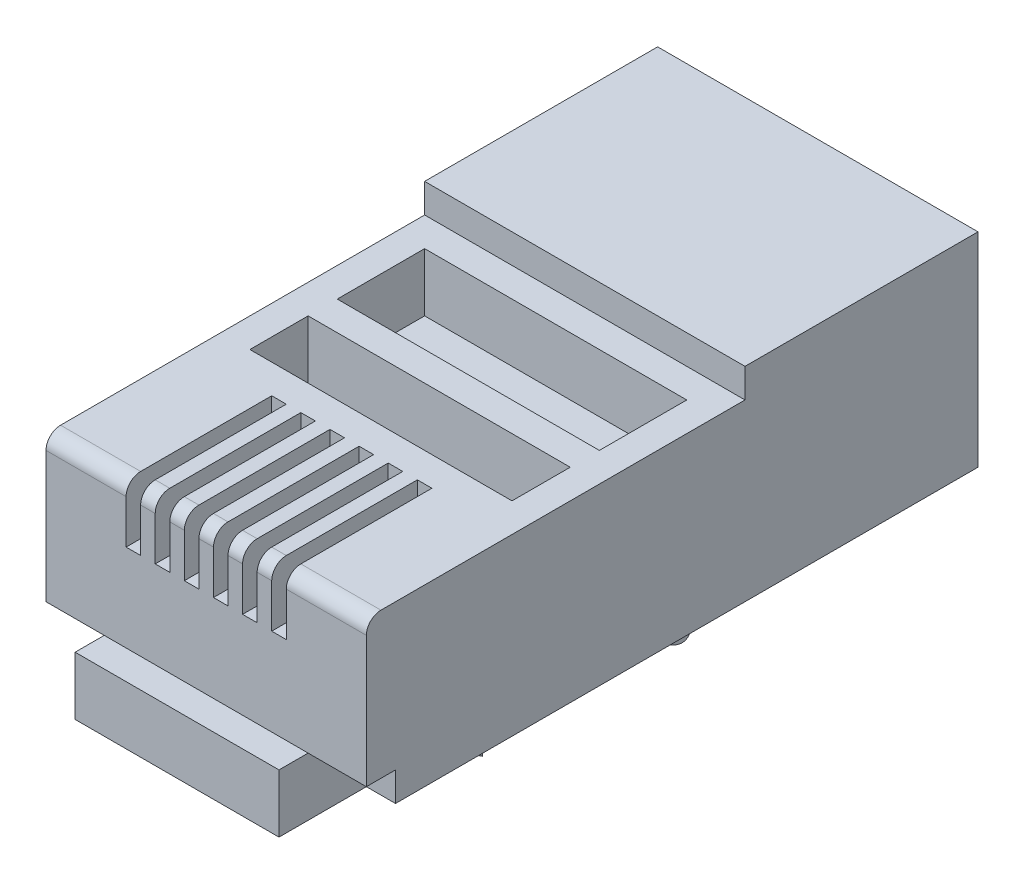
from build123d import *

# Parameters (mm, degrees)
BOSS_EXTRUDE1_DEPTH = 5
SKETCH2_W           = 11
SKETCH2_H           = 6
BOSS_EXTRUDE2_DEPTH = 8
SKETCH3_W           = 9
SKETCH3_H           = 2
CUT_EXTRUDE1_DEPTH  = 2
SKETCH5_W           = 9
SKETCH5_H           = 3
CUT_EXTRUDE2_DEPTH  = 2
SKETCH7_W           = 11
SKETCH7_H           = 7
BOSS_EXTRUDE3_DEPTH = 8
SKETCH8_W           = 7
SKETCH8_H           = 2
BOSS_EXTRUDE4_DEPTH = 1
SKETCH9_W           = 2
SKETCH9_H           = 1
CUT_EXTRUDE3_DEPTH  = 1
SKETCH10_W          = 7
SKETCH10_H          = 3
BOSS_EXTRUDE5_DEPTH = 1
BOSS_EXTRUDE6_DEPTH = 7
BOSS_EXTRUDE7_DEPTH = 5
SKETCH14_W          = 0.5
SKETCH14_H          = 2
CUT_EXTRUDE4_DEPTH  = 1
SKETCH15_W          = 7
SKETCH15_H          = 3
CUT_EXTRUDE5_DEPTH  = 8
SKETCH16_R          = 0.25
CUT_EXTRUDE10_DEPTH = 10
FILLET1_R           = 0.5


with BuildPart() as part:
    # Sketch1 → Boss-Extrude1 (new body)
    with BuildSketch(Plane.XY):
        Polygon((-53.574922408, 6), (-50.824922408, 6), (-50.824922408, 0), (-61.824922408, 0), (-61.824922408, 6), (-59.074922408, 6), (-59.074922408, 4), (-58.574922408, 4), (-58.574922408, 6), (-58.074922408, 6), (-58.074922408, 4), (-57.574922408, 4), (-57.574922408, 6), (-57.074922408, 6), (-57.074922408, 4), (-56.574922408, 4), (-56.574922408, 6), (-56.074922408, 6), (-56.074922408, 4), (-55.574922408, 4), (-55.574922408, 6), (-55.074922408, 6), (-55.074922408, 4), (-54.574922408, 4), (-54.574922408, 6), (-54.074922408, 6), (-54.074922408, 4), (-53.574922408, 4), align=None)
    extrude(amount=-BOSS_EXTRUDE1_DEPTH)

    # Sketch2 → Boss-Extrude2 (add)
    with BuildSketch(Plane(origin=(0, 0, -5), x_dir=(-1, 0, 0), z_dir=(0, 0, -1))):
        with Locations((56.324922408, 3)):
            Rectangle(SKETCH2_W, SKETCH2_H)
    extrude(amount=BOSS_EXTRUDE2_DEPTH)

    # Sketch3 → Cut-Extrude1 (cut)
    with BuildSketch(Plane(origin=(0, 6, 0), x_dir=(1, 0, 0), z_dir=(0, 1, 0))):
        with Locations((-56.324922408, 7)):
            Rectangle(SKETCH3_W, SKETCH3_H)
    extrude(amount=-CUT_EXTRUDE1_DEPTH, mode=Mode.SUBTRACT)

    # Sketch5 → Cut-Extrude2 (cut)
    with BuildSketch(Plane(origin=(0, 6, 0), x_dir=(1, 0, 0), z_dir=(0, 1, 0))):
        with Locations((-56.324922408, 10.5)):
            Rectangle(SKETCH5_W, SKETCH5_H)
    extrude(amount=-CUT_EXTRUDE2_DEPTH, mode=Mode.SUBTRACT)

    # Sketch7 → Boss-Extrude3 (add)
    with BuildSketch(Plane(origin=(0, 0, -13), x_dir=(-1, 0, 0), z_dir=(0, 0, -1))):
        with Locations((56.324922408, 3.5)):
            Rectangle(SKETCH7_W, SKETCH7_H)
    extrude(amount=BOSS_EXTRUDE3_DEPTH)

    # Sketch8 → Boss-Extrude4 (add)
    with BuildSketch(Plane.XY):
        with Locations((-56.324922408, 0)):
            Rectangle(SKETCH8_W, SKETCH8_H)
    extrude(amount=BOSS_EXTRUDE4_DEPTH)

    # Sketch9 → Cut-Extrude3 (cut)
    with BuildSketch(Plane.XY):
        with Locations((-60.824922408, 0.5)):
            Rectangle(SKETCH9_W, SKETCH9_H)
        with Locations((-51.824922408, 0.5)):
            Rectangle(SKETCH9_W, SKETCH9_H)
    extrude(amount=-CUT_EXTRUDE3_DEPTH, mode=Mode.SUBTRACT)

    # Sketch10 → Boss-Extrude5 (add)
    with BuildSketch(Plane.XZ):
        with Locations((-56.324922408, -1.5)):
            Rectangle(SKETCH10_W, SKETCH10_H)
    extrude(amount=BOSS_EXTRUDE5_DEPTH)

    # Sketch12 → Boss-Extrude6 (add)
    with BuildSketch(Plane(origin=(-52.824922408, 0, 0), x_dir=(0, 0, -1), z_dir=(1, 0, 0))):
        Polygon((3, 0), (5.992424207, -0.484369133), (5.992424207, -2.095529726), (4.896502139, -1.339612629), (3, -1), align=None)
    extrude(amount=-BOSS_EXTRUDE6_DEPTH)

    # Sketch13 → Boss-Extrude7 (add)
    with BuildSketch(Plane(origin=(-53.824922408, 0, 0), x_dir=(0, 0, -1), z_dir=(1, 0, 0))):
        with BuildLine():
            Line((14.148954215, -2.461888554), (14.148954215, -2.839825861))
            ThreePointArc((14.148954215, -2.839825861), (14.071635021, -3.040856353), (13.87953249, -3.138263407))
            add(Edge.make_bspline(
                [(5.992424207, -2.095529726), (8.29118563, -2.416616876), (10.932584268, -1.908869196), (13.449456914, -2.990370177), (13.696503578, -3.157016773), (13.87953249, -3.138263407)],
                knots=[0, 0, 0, 0, 0.841667249, 0.882833834, 0.948247019, 0.948247019, 0.948247019, 0.948247019], degree=3))
            Line((5.992424207, -2.095529726), (5.992424207, -0.484369133))
            add(Edge.make_bspline(
                [(5.992424207, -0.484369133), (8.707741723, -0.750205277), (11.359938613, -1.314908717), (13.943929605, -2.177319274)],
                knots=[0, 0, 0, 0, 0.957734947, 0.957734947, 0.957734947, 0.957734947], degree=3))
            ThreePointArc((13.943929605, -2.177319274), (14.092359861, -2.28652125), (14.148954215, -2.461888554))
        make_face()
    extrude(amount=-BOSS_EXTRUDE7_DEPTH)

    # Sketch14 → Cut-Extrude4 (cut)
    with BuildSketch(Plane(origin=(0, 4, 0), x_dir=(1, 0, 0), z_dir=(0, 1, 0))):
        with Locations((-53.824922408, 2.5)):
            Rectangle(SKETCH14_W, SKETCH14_H)
        with Locations((-54.824922408, 2.5)):
            Rectangle(SKETCH14_W, SKETCH14_H)
        with Locations((-55.824922408, 2.5)):
            Rectangle(SKETCH14_W, SKETCH14_H)
        with Locations((-56.824922408, 2.5)):
            Rectangle(SKETCH14_W, SKETCH14_H)
        with Locations((-57.824922408, 2.5)):
            Rectangle(SKETCH14_W, SKETCH14_H)
        with Locations((-58.824922408, 2.5)):
            Rectangle(SKETCH14_W, SKETCH14_H)
    extrude(amount=-CUT_EXTRUDE4_DEPTH, mode=Mode.SUBTRACT)

    # Sketch15 → Cut-Extrude5 (cut)
    with BuildSketch(Plane(origin=(0, 0, -21), x_dir=(-1, 0, 0), z_dir=(0, 0, -1))):
        with Locations((56.324922408, 3.5)):
            Rectangle(SKETCH15_W, SKETCH15_H)
    extrude(amount=-CUT_EXTRUDE5_DEPTH, mode=Mode.SUBTRACT)

    # Sketch16 → Cut-Extrude10 (cut)
    with BuildSketch(Plane(origin=(0, 0, -13), x_dir=(-1, 0, 0), z_dir=(0, 0, -1))):
        with Locations((53.824922408, 3.25)):
            Circle(SKETCH16_R)
        with Locations((54.824922408, 3.25)):
            Circle(SKETCH16_R)
        with Locations((55.824922408, 3.25)):
            Circle(SKETCH16_R)
        with Locations((56.824922408, 3.25)):
            Circle(SKETCH16_R)
        with Locations((57.824922408, 3.25)):
            Circle(SKETCH16_R)
        with Locations((58.824922408, 3.25)):
            Circle(SKETCH16_R)
    extrude(amount=-CUT_EXTRUDE10_DEPTH, mode=Mode.SUBTRACT)

    # Fillet1
    fillet1_edges = [part.edges().sort_by_distance(p)[0] for p in [
        (-60.449922408, 6, 0),
        (-58.324922408, 6, 0),
        (-57.324922408, 6, 0),
        (-56.324922408, 6, 0),
        (-55.324922408, 6, 0),
        (-54.324922408, 6, 0),
        (-52.199922408, 6, 0),
    ]]
    fillet(fillet1_edges, radius=FILLET1_R)


solid = part.part
